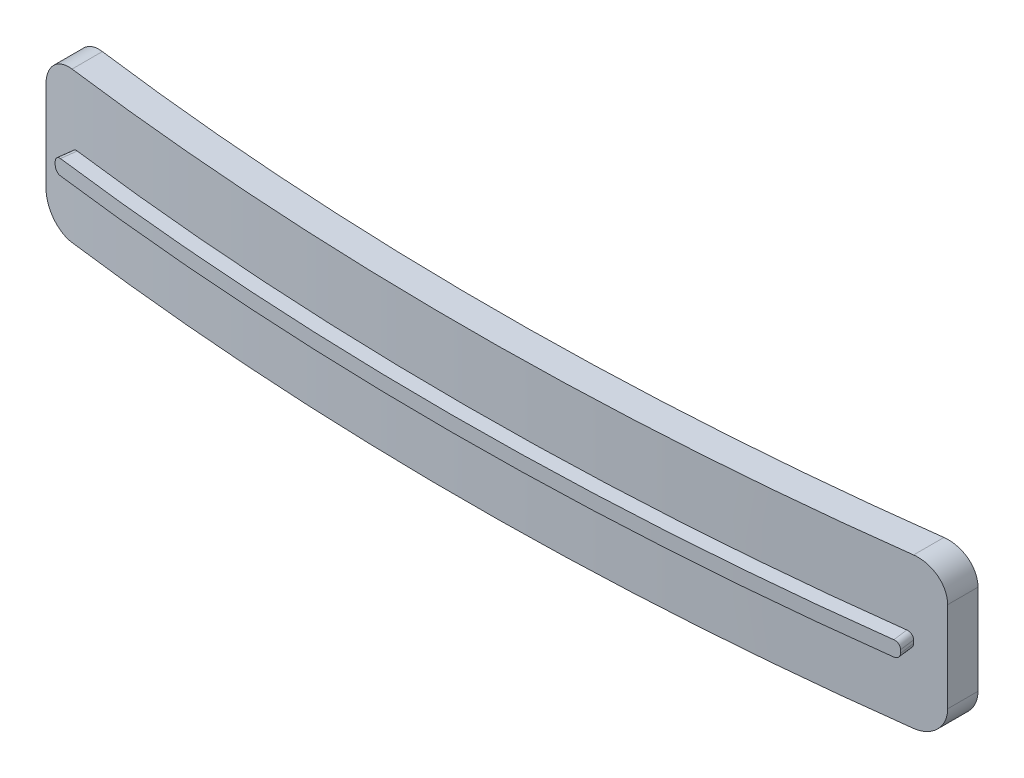
from build123d import *

# Parameters (mm, degrees)
BOSS_EXTRUDE1_DEPTH = 50
FILLET1_R           = 10
BOSS_EXTRUDE2_DEPTH = 2.5
FILLET3_R           = 2


with BuildPart() as part:
    # Sketch1 → Boss-Extrude1 (new body)
    with BuildSketch(Plane(origin=(0, 0, 0), x_dir=(1, 0, 0), z_dir=(0, 1, 0))):
        with BuildLine():
            Line((-150, -1076.600668772), (-150, -1086.696369737))
            ThreePointArc((-150, -1086.696369737), (0, -1097), (150, -1086.696369737))
            Line((150, -1086.696369737), (150, -1076.600668772))
            ThreePointArc((150, -1076.600668772), (0, -1087), (-150, -1076.600668772))
        make_face()
    extrude(amount=BOSS_EXTRUDE1_DEPTH)

    # Fillet1
    fillet1_edges = [part.edges().sort_by_distance(p)[0] for p in [
        (150, 50, 1081.648519255),
        (150, 0, 1081.648519255),
        (-150, 0, 1081.648519255),
        (-150, 50, 1081.648519255),
    ]]
    fillet(fillet1_edges, radius=FILLET1_R)

    # Sketch3 → Boss-Extrude2 (add, symmetric)
    with BuildSketch(Plane(origin=(0, 25, 0), x_dir=(1, 0, 0), z_dir=(0, 1, 0))):
        with BuildLine():
            Line((-140, -1088.029870913), (-140.63810392, -1092.988986095))
            ThreePointArc((-140.63810392, -1092.988986095), (0, -1102), (140.63810392, -1092.988986095))
            Line((140.63810392, -1092.988986095), (140, -1088.029870913))
            ThreePointArc((140, -1088.029870913), (0, -1097), (-140, -1088.029870913))
        make_face()
    extrude(amount=BOSS_EXTRUDE2_DEPTH, both=True)

    # Fillet3
    fillet3_edges = [part.edges().sort_by_distance(p)[0] for p in [
        (-140.31905196, 22.5, 1090.509428504),
        (140.31905196, 22.5, 1090.509428504),
        (-140.31905196, 27.5, 1090.509428504),
        (140.31905196, 27.5, 1090.509428504),
    ]]
    fillet(fillet3_edges, radius=FILLET3_R)


solid = part.part
